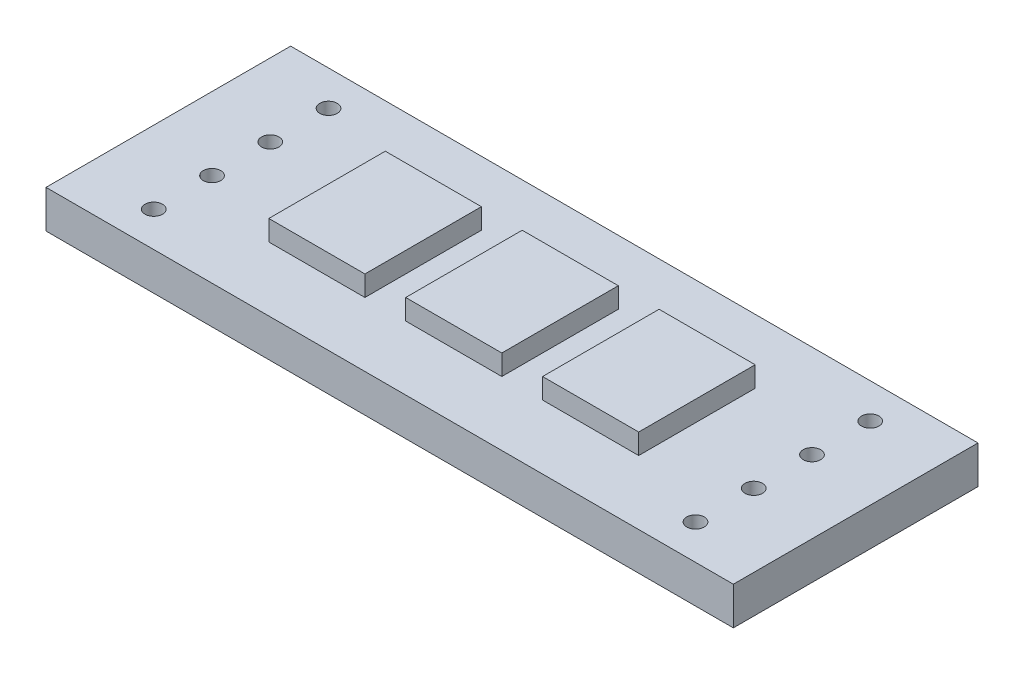
from build123d import *

# Parameters (mm, degrees)
SKETCH1_W           = 29.972
SKETCH1_H           = 10.668
BOSS_EXTRUDE1_DEPTH = 1.651
SKETCH2_W           = 4.191
SKETCH2_H           = 5.08
BOSS_EXTRUDE2_DEPTH = 0.889
SKETCH3_R           = 0.381
CUT_EXTRUDE1_DEPTH  = 32.856754527


with BuildPart() as part:
    # Sketch1 → Boss-Extrude1 (new body)
    with BuildSketch(Plane(origin=(0, 0, 0), x_dir=(1, 0, 0), z_dir=(0, 1, 0))):
        with Locations((14.986, 5.334)):
            Rectangle(SKETCH1_W, SKETCH1_H)
    extrude(amount=BOSS_EXTRUDE1_DEPTH)

    # Sketch2 → Boss-Extrude2 (add)
    with BuildSketch(Plane(origin=(0, 1.651, 0), x_dir=(1, 0, 0), z_dir=(0, 1, 0))):
        with Locations((14.986, 5.334)):
            Rectangle(SKETCH2_W, SKETCH2_H)
        with Locations((9.017, 5.334)):
            Rectangle(SKETCH2_W, SKETCH2_H)
        with Locations((20.955, 5.334)):
            Rectangle(SKETCH2_W, SKETCH2_H)
    extrude(amount=BOSS_EXTRUDE2_DEPTH)

    # Sketch3 → Cut-Extrude1 (cut, through all)
    with BuildSketch(Plane(origin=(0, 1.651, 0), x_dir=(1, 0, 0), z_dir=(0, 1, 0))):
        with Locations(Location((26.797, 1.524, 0), (0, 0, 270))):
            Circle(SKETCH3_R)
        with Locations(Location((26.797, 4.064, 0), (0, 0, 270))):
            Circle(SKETCH3_R)
        with Locations(Location((26.797, 6.604, 0), (0, 0, 90))):
            Circle(SKETCH3_R)
        with Locations(Location((26.797, 9.144, 0), (0, 0, 90))):
            Circle(SKETCH3_R)
        with Locations(Location((3.175, 1.524, 0), (0, 0, 90))):
            Circle(SKETCH3_R)
        with Locations(Location((3.175, 4.064, 0), (0, 0, 90))):
            Circle(SKETCH3_R)
        with Locations(Location((3.175, 6.604, 0), (0, 0, 270))):
            Circle(SKETCH3_R)
        with Locations(Location((3.175, 9.144, 0), (0, 0, 270))):
            Circle(SKETCH3_R)
    extrude(amount=-CUT_EXTRUDE1_DEPTH, mode=Mode.SUBTRACT)


solid = part.part
